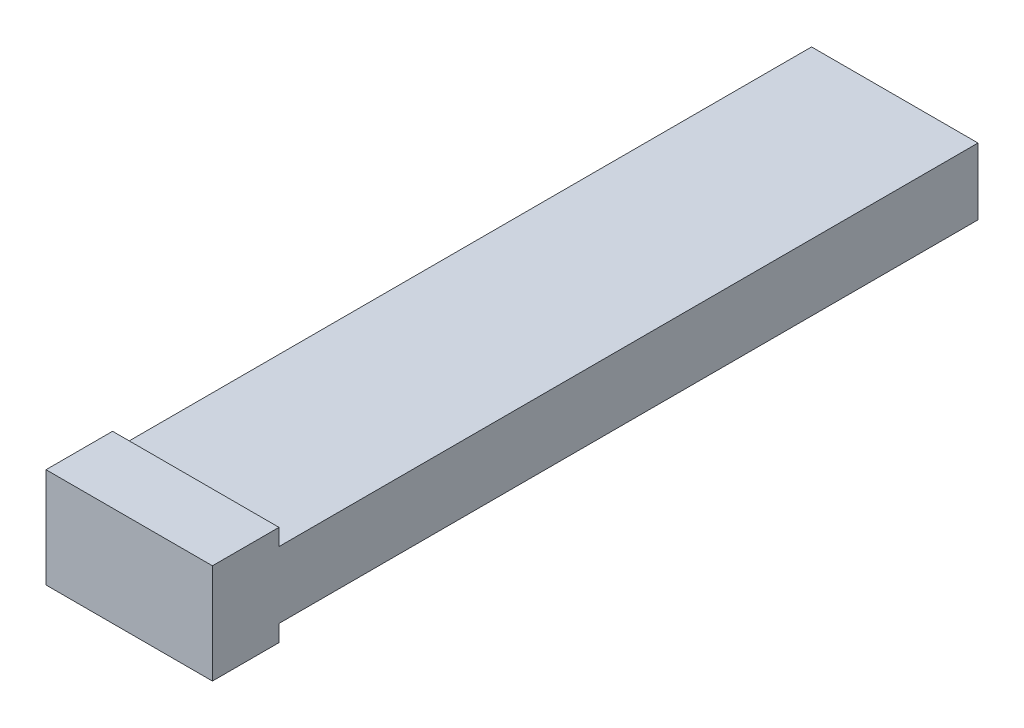
from build123d import *

# Parameters (mm, degrees)
ESQUISSE1_W        = 5
ESQUISSE1_H        = 2
BOSS_EXTRU_1_DEPTH = 21
ESQUISSE2_W        = 5
ESQUISSE2_H        = 3
BOSS_EXTRU_2_DEPTH = 2


with BuildPart() as part:
    # Esquisse1 → Boss.-Extru.1 (new body)
    with BuildSketch(Plane.XY):
        Rectangle(ESQUISSE1_W, ESQUISSE1_H)
    extrude(amount=BOSS_EXTRU_1_DEPTH)

    # Esquisse2 → Boss.-Extru.2 (add)
    with BuildSketch(Plane.XY.offset(21)):
        Rectangle(ESQUISSE2_W, ESQUISSE2_H)
    extrude(amount=BOSS_EXTRU_2_DEPTH)


solid = part.part
